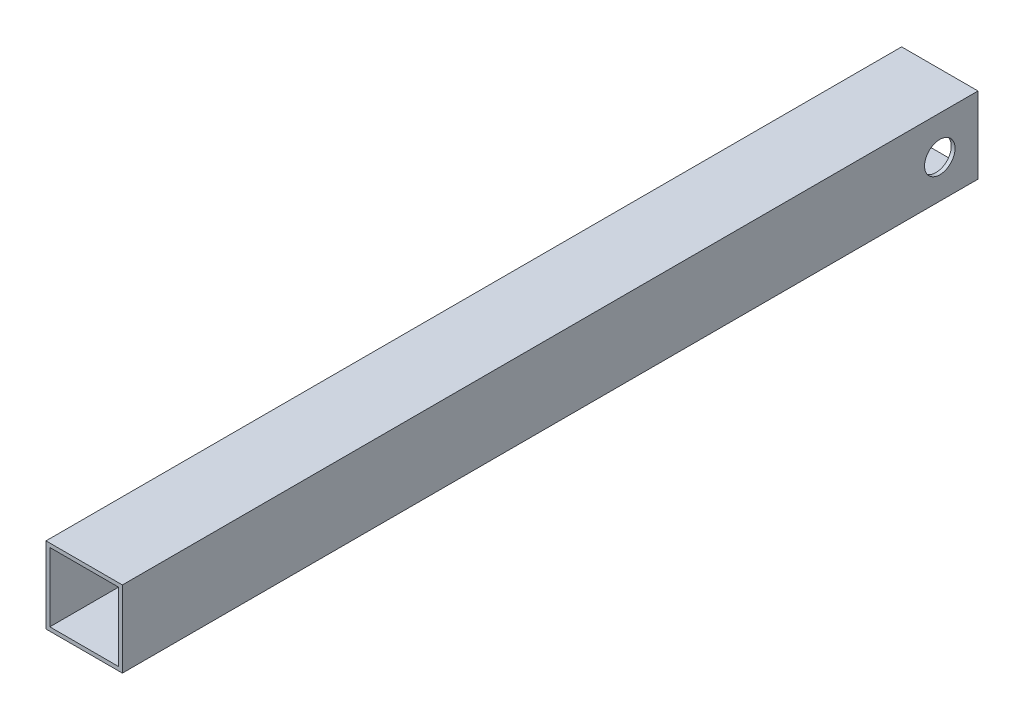
from build123d import *

# Parameters (mm, degrees)
SKETCH1_W           = 63.5
SKETCH1_H           = 63.5
SKETCH1_W_2         = 57.15
SKETCH1_H_2         = 57.15
BOSS_EXTRUDE1_DEPTH = 355.6
SKETCH2_R           = 12.7
CUT_EXTRUDE1_DEPTH  = 363.617804996


with BuildPart() as part:
    # Sketch1 → Boss-Extrude1 (new, symmetric)
    with BuildSketch(Plane.XY):
        Rectangle(SKETCH1_W, SKETCH1_H)
        Rectangle(SKETCH1_W_2, SKETCH1_H_2, mode=Mode.SUBTRACT)
    extrude(amount=BOSS_EXTRUDE1_DEPTH, both=True)

    # Sketch2 → Cut-Extrude1 (cut, through all)
    with BuildSketch(Plane.ZY.offset(31.75)):
        with Locations((-323.85, 0)):
            Circle(SKETCH2_R)
    extrude(amount=-CUT_EXTRUDE1_DEPTH, mode=Mode.SUBTRACT)


solid = part.part
